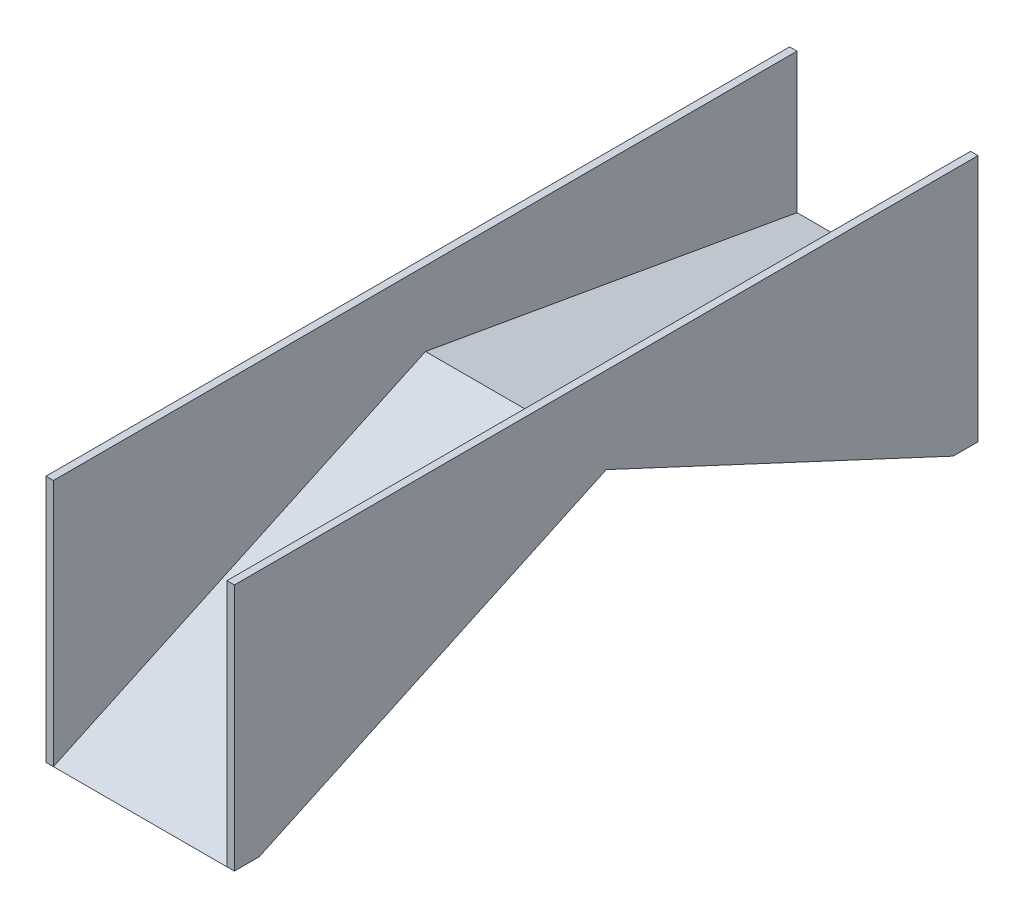
from build123d import *

# Parameters (mm, degrees)
SKETCH1_W           = 70
SKETCH1_H           = 300
BOSS_EXTRUDE1_DEPTH = 70
SKETCH1_4_W         = 3
SKETCH1_4_H         = 300
BOSS_EXTRUDE2_DEPTH = 100
CUT_EXTRUDE1_DEPTH  = 70
CUT_EXTRUDE2_DEPTH  = 70
CUT_EXTRUDE3_DEPTH  = 205.769718293
SKETCH10_W          = 50
SKETCH10_H          = 70
CUT_EXTRUDE4_DEPTH  = 30


with BuildPart() as part:
    # Sketch1 → Boss-Extrude1 (new body)
    with BuildSketch(Plane(origin=(0, 0, 0), x_dir=(1, 0, 0), z_dir=(0, 1, 0))):
        with Locations((-11.73177624, -11.723954719)):
            Rectangle(SKETCH1_W, SKETCH1_H)
    extrude(amount=BOSS_EXTRUDE1_DEPTH)

    # Sketch1<4> → Boss-Extrude2 (add)
    with BuildSketch(Plane(origin=(0, 0, 0), x_dir=(1, 0, 0), z_dir=(0, 1, 0))):
        with Locations((-48.23177624, -11.723954719)):
            Rectangle(SKETCH1_4_W, SKETCH1_4_H)
        with Locations((24.76822376, -11.723954719)):
            Rectangle(SKETCH1_4_W, SKETCH1_4_H)
    extrude(amount=BOSS_EXTRUDE2_DEPTH)

    # Sketch2 → Cut-Extrude1 (cut)
    with BuildSketch(Plane.ZY.offset(46.73177624)):
        Polygon((161.723954719, 70), (11.608470283, 70), (161.723954719, 0), align=None)
    extrude(amount=-CUT_EXTRUDE1_DEPTH, mode=Mode.SUBTRACT)

    # Sketch3 → Cut-Extrude2 (cut)
    with BuildSketch(Plane.ZY.offset(46.73177624)):
        Polygon((11.608470283, 70), (-138.276045281, 70), (-138.276045281, 43.571315916), align=None)
    extrude(amount=-CUT_EXTRUDE2_DEPTH, mode=Mode.SUBTRACT)

    # Sketch8 → Cut-Extrude3 (cut, through all)
    with BuildSketch(Plane(origin=(26.26822376, 0, 0), x_dir=(0, 0, -1), z_dir=(1, 0, 0))):
        Polygon((-151.723954719, 0), (-11.723954719, 65.283072142), (128.276045281, 0), (-11.723954719, 0), align=None)
    extrude(amount=-CUT_EXTRUDE3_DEPTH, mode=Mode.SUBTRACT)

    # Sketch10 → Cut-Extrude4 (cut)
    with BuildSketch(Plane.XZ):
        with Locations((-11.73177624, -93.276045281)):
            Rectangle(SKETCH10_W, SKETCH10_H)
    extrude(amount=-CUT_EXTRUDE4_DEPTH, mode=Mode.SUBTRACT)


solid = part.part
